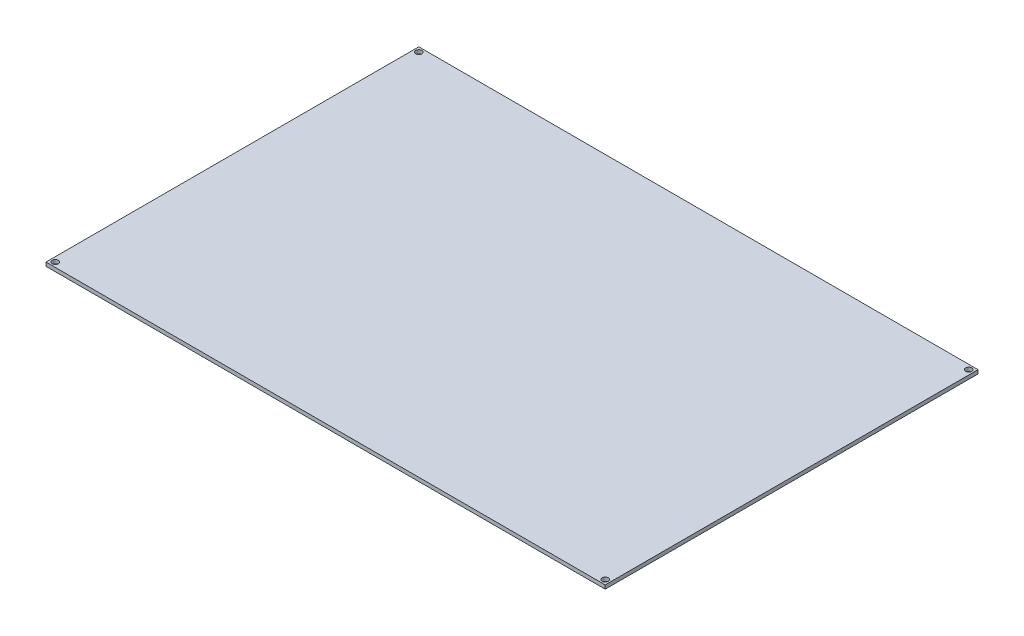
from build123d import *

# Parameters (mm, degrees)
SKETCH1_W           = 300
SKETCH1_H           = 200
SKETCH1_R           = 1.65
BOSS_EXTRUDE1_DEPTH = 2


with BuildPart() as part:
    # Sketch1 → Boss-Extrude1 (new body)
    with BuildSketch(Plane(origin=(0, 0, 0), x_dir=(1, 0, 0), z_dir=(0, 1, 0))):
        with Locations((150, 100)):
            Rectangle(SKETCH1_W, SKETCH1_H)
        with Locations(Location((2.5, 2.5, 0), (0, 0, 270))):
            Circle(SKETCH1_R, mode=Mode.SUBTRACT)
        with Locations(Location((297.5, 2.5, 0), (0, 0, 90))):
            Circle(SKETCH1_R, mode=Mode.SUBTRACT)
        with Locations(Location((297.5, 197.5, 0), (0, 0, 270))):
            Circle(SKETCH1_R, mode=Mode.SUBTRACT)
        with Locations(Location((2.5, 197.5, 0), (0, 0, 90))):
            Circle(SKETCH1_R, mode=Mode.SUBTRACT)
    extrude(amount=BOSS_EXTRUDE1_DEPTH)


solid = part.part
